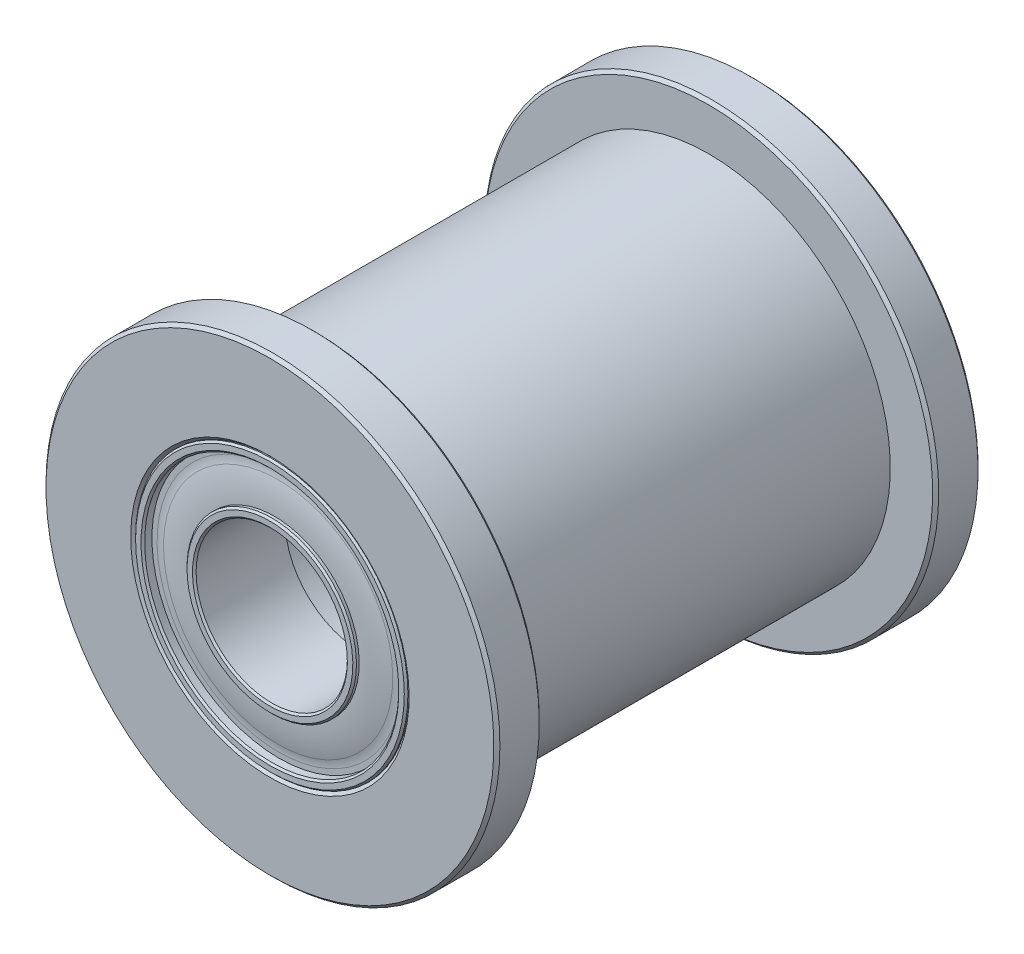
from build123d import *

# Parameters (mm, degrees)
CHAMFER2_SIZE = 0.06
FILLET2_R     = 1
CHAMFER1_SIZE = 0.1


with BuildPart() as part:
    # Sketch2 → Revolve1 (revolve)
    with BuildSketch(Plane(origin=(0, 0, 0), x_dir=(0, 0, -1), z_dir=(1, 0, 0)), mode=Mode.PRIVATE) as revolve1_sk:
        with BuildLine():
            Line((8, 2.5), (5, 2.5))
            Line((5, 2.5), (5, 4.5))
            Line((5, 4.5), (8, 4.5))
            Line((8, 4.5), (8, 4.2))
            Line((8, 4.2), (7.7, 4.2))
            Line((7.7, 4.2), (7.7, 3.9))
            ThreePointArc((7.7, 3.9), (7.812327274, 3.355090083), (7.85, 2.8))
            Line((7.85, 2.8), (8, 2.8))
            Line((8, 2.8), (8, 2.5))
        make_face()
    revolve(revolve1_sk.sketch.rotate(Axis((0, 0, 8), (0, 0, -1)), 180), axis=Axis((0, 0, 8), (0, 0, -1)))

    # Chamfer2
    chamfer2_edges = [part.edges().sort_by_distance(p)[0] for p in [
        (0, 2.5, -8),
        (0, 2.8, -8),
        (0, 4.2, -8),
        (0, 4.5, -8),
    ]]
    chamfer(chamfer2_edges, length=CHAMFER2_SIZE)

    # Fillet2
    fillet2_edges = [part.edges().sort_by_distance(p)[0] for p in [
        (0, 3.9, -7.7),
    ]]
    fillet(fillet2_edges, radius=FILLET2_R)


with BuildPart() as body_2:
    # Mirror1: mirrored copy
    add(part.part.mirror(Plane.XY))


with BuildPart() as body_3:
    # Sketch3 → Revolve2 (revolve)
    with BuildSketch(Plane(origin=(0, 0, 0), x_dir=(0, 0, -1), z_dir=(1, 0, 0)), mode=Mode.PRIVATE) as revolve2_sk:
        Polygon((6.5, 7.5), (8, 7.5), (8, 4.5), (5, 4.5), (5, 3.5), (-5, 3.5), (-5, 4.5), (-8, 4.5), (-8, 7.5), (-6.5, 7.5), (-6.5, 6), (6.5, 6), align=None)
    revolve(revolve2_sk.sketch.rotate(Axis((0, 0, 8), (0, 0, -1)), 180), axis=Axis((0, 0, 8), (0, 0, -1)))

    # Chamfer1
    chamfer1_edges = [body_3.edges().sort_by_distance(p)[0] for p in [
        (0, 4.5, 8),
        (0, 4.5, -8),
        (0, 7.5, -8),
        (0, 7.5, -6.5),
        (0, 7.5, 6.5),
        (0, 7.5, 8),
    ]]
    chamfer(chamfer1_edges, length=CHAMFER1_SIZE)


solid = Compound([part.part, body_2.part, body_3.part])
